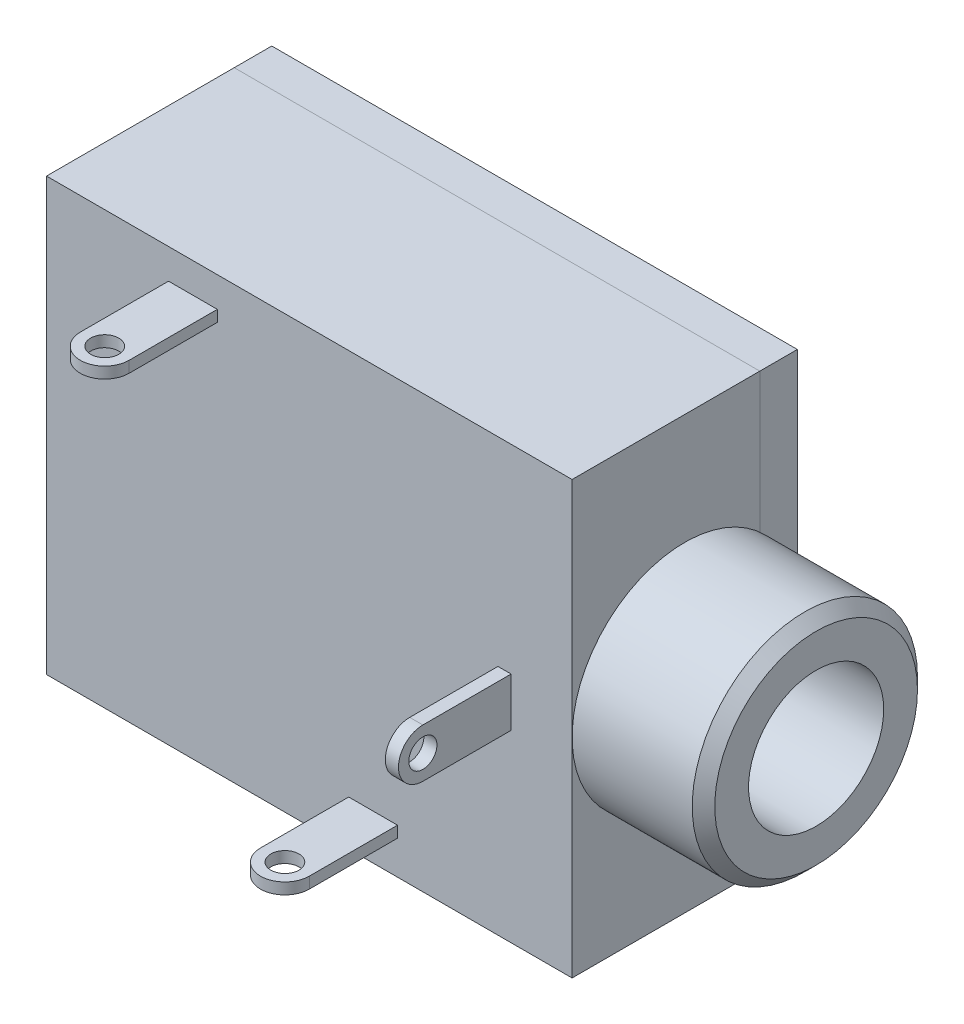
from build123d import *

# Parameters (mm, degrees)
SKETCH1_W           = 14
SKETCH1_H           = 11.5
BOSS_EXTRUDE1_DEPTH = 1
SKETCH6_W           = 14
SKETCH6_H           = 11.5
BOSS_EXTRUDE2_DEPTH = 5
SKETCH12_R          = 3
BOSS_EXTRUDE3_DEPTH = 3.5
BOSS_EXTRUDE4_DEPTH = 0.3
BOSS_EXTRUDE5_DEPTH = 0.35
BOSS_EXTRUDE6_DEPTH = 0.3
SKETCH37_W          = 0.375
SKETCH37_H          = 1.2
SKETCH39_W          = 0.375
SKETCH39_H          = 5.475
SKETCH41_W          = 0.375
SKETCH41_H          = 1.1
SKETCH43_W          = 1.8
SKETCH43_H          = 3.5
CHAMFER1_SIZE       = 0.3


with BuildPart() as part:
    # Sketch1 → Boss-Extrude1 (new body)
    with BuildSketch(Plane(origin=(0, 0, -3), x_dir=(-1, 0, 0), z_dir=(0, 0, -1))):
        with Locations((10.5, 0.2)):
            Rectangle(SKETCH1_W, SKETCH1_H)
    extrude(amount=-BOSS_EXTRUDE1_DEPTH)


with BuildPart() as body_2:
    # Sketch6 → Boss-Extrude2 (new body)
    with BuildSketch(Plane.XY.offset(3)):
        with Locations((-10.5, 0.2)):
            Rectangle(SKETCH6_W, SKETCH6_H)
    extrude(amount=-BOSS_EXTRUDE2_DEPTH)


with BuildPart() as body_3:
    # Sketch12 → Boss-Extrude3 (new body)
    with BuildSketch(Plane(origin=(-3.5, 0, 0), x_dir=(0, 0, -1), z_dir=(1, 0, 0))):
        Circle(SKETCH12_R)
    extrude(amount=BOSS_EXTRUDE3_DEPTH)

    # Sketch43 → Ø3.6 (3.6) Diameter Hole1 (revolve, cut)
    with BuildSketch(Plane(origin=(0, 0, 0), x_dir=(0, 0, -1), z_dir=(0, 1, 0))):
        with Locations((0.9, 1.75)):
            Rectangle(SKETCH43_W, SKETCH43_H)
    revolve(axis=Axis((6.35, 0, 0), (-1, 0, 0)), mode=Mode.SUBTRACT)

    # Chamfer1
    chamfer1_edges = [body_3.edges().sort_by_distance(p)[0] for p in [
        (0, 0, 3),
    ]]
    chamfer(chamfer1_edges, length=CHAMFER1_SIZE)


with BuildPart() as body_4:
    # Sketch19 → Boss-Extrude4 (new body)
    with BuildSketch(Plane(origin=(0, 5.15, 0), x_dir=(1, 0, 0), z_dir=(0, 1, 0))):
        with BuildLine():
            Line((-14.25, -3), (-14.25, -5.35))
            ThreePointArc((-14.25, -5.35), (-13.6, -6), (-12.95, -5.35))
            Line((-12.95, -5.35), (-12.95, -3))
            Line((-12.95, -3), (-14.25, -3))
        make_face()
    extrude(amount=-BOSS_EXTRUDE4_DEPTH)

    # Sketch41 → Ø0.75 (0.75) Diameter Hole3 (revolve, cut)
    with BuildSketch(Plane(origin=(-13.6, 4.85, 5.35), x_dir=(0, 0, -1), z_dir=(1, 0, 0))):
        with Locations((0.1875, 0.55)):
            Rectangle(SKETCH41_W, SKETCH41_H)
    revolve(axis=Axis((-13.6, -1.5, 5.35), (0, 1, 0)), mode=Mode.SUBTRACT)


with BuildPart() as body_5:
    # Sketch27 → Boss-Extrude5 (new body)
    with BuildSketch(Plane.ZY.offset(5.475)):
        with BuildLine():
            Line((3, -0.65), (5.35, -0.65))
            ThreePointArc((5.35, -0.65), (6, 0), (5.35, 0.65))
            Line((5.35, 0.65), (3, 0.65))
            Line((3, 0.65), (3, -0.65))
        make_face()
    extrude(amount=-BOSS_EXTRUDE5_DEPTH)

    # Sketch39 → Ø0.75 (0.75) Diameter Hole2 (revolve, cut)
    with BuildSketch(Plane(origin=(-5.475, 0, 5.35), x_dir=(0, 0, 1), z_dir=(0, 1, 0))):
        with Locations((0.1875, 2.7375)):
            Rectangle(SKETCH39_W, SKETCH39_H)
    revolve(axis=Axis((-11.825, 0, 5.35), (1, 0, 0)), mode=Mode.SUBTRACT)


with BuildPart() as body_6:
    # Sketch36 → Boss-Extrude6 (new body)
    with BuildSketch(Plane(origin=(0, -4.35, 0), x_dir=(1, 0, 0), z_dir=(0, 1, 0))):
        with BuildLine():
            Line((-9.45, -3), (-9.45, -5.35))
            ThreePointArc((-9.45, -5.35), (-8.8, -6), (-8.15, -5.35))
            Line((-8.15, -5.35), (-8.15, -3))
            Line((-8.15, -3), (-9.45, -3))
        make_face()
    extrude(amount=-BOSS_EXTRUDE6_DEPTH)

    # Sketch37 → Ø0.75 (0.75) Diameter Hole1 (revolve, cut)
    with BuildSketch(Plane(origin=(-8.8, -4.35, 5.35), x_dir=(0, 0, 1), z_dir=(1, 0, 0))):
        with Locations((0.1875, 0.6)):
            Rectangle(SKETCH37_W, SKETCH37_H)
    revolve(axis=Axis((-8.8, 2, 5.35), (0, -1, 0)), mode=Mode.SUBTRACT)


solid = Compound([part.part, body_2.part, body_3.part, body_4.part, body_5.part, body_6.part])
